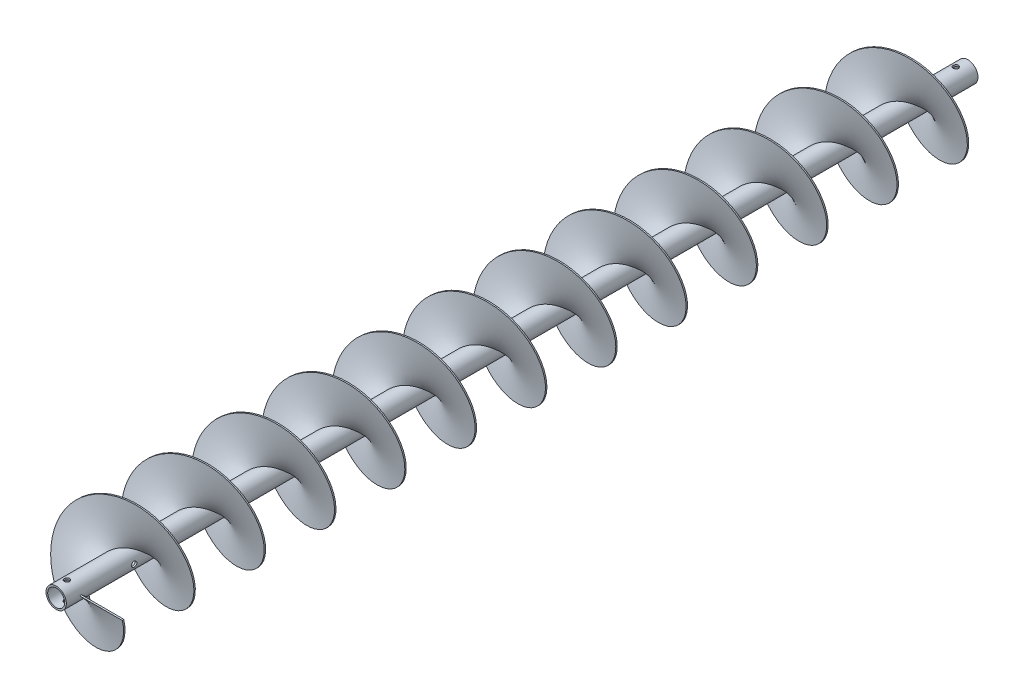
from build123d import *

# Parameters (mm, degrees)
SKETCH1_R               = 21
SKETCH1_R_2             = 17.5
EXTRUDE_THIN1_DEPTH     = 1880
SWEEP1_PITCH            = 145
SWEEP1_HEIGHT           = 1800
SWEEP1_RADIUS           = 65
SWEEP1_START_ANGLE      = 180
SKETCH7_W               = 88
SKETCH7_H               = 2.915603922
CUT_EXTRUDE1_DEPTH      = 1887.309629217
CUT_EXTRUDE1_DEPTH_BACK = 1887.309629217
SKETCH9_R               = 5.5
CUT_EXTRUDE2_DEPTH      = 1887.309629317
CUT_EXTRUDE2_DEPTH_BACK = 1887.309629317
SKETCH10_R              = 5.5


with BuildPart() as part:
    # Sketch1 → Extrude-Thin1 (new body)
    with BuildSketch(Plane.XY):
        Circle(SKETCH1_R)
        Circle(SKETCH1_R_2, mode=Mode.SUBTRACT)
    extrude(amount=-EXTRUDE_THIN1_DEPTH)

    # Sketch9 → Cut-Extrude1 (cut, two sides: drawn at the far end of the back side and taken through both)
    with BuildSketch(Plane(origin=(0, 0, 0), x_dir=(0, 0, -1), z_dir=(1, 0, 0)).offset(-CUT_EXTRUDE1_DEPTH_BACK)):
        with Locations((140, 0)):
            Circle(SKETCH9_R)
        with Locations((1790, 0)):
            Circle(SKETCH9_R)
    extrude(amount=CUT_EXTRUDE1_DEPTH + CUT_EXTRUDE1_DEPTH_BACK, mode=Mode.SUBTRACT)

    # Sketch10 → Cut-Extrude2 (cut, two sides: drawn at the far end of the back side and taken through both)
    with BuildSketch(Plane(origin=(0, 0, 0), x_dir=(1, 0, 0), z_dir=(0, 1, 0)).offset(-CUT_EXTRUDE2_DEPTH_BACK)):
        with Locations(Location((0, 22, 0), (0, 0, 270))):
            Circle(SKETCH10_R)
        with Locations(Location((0, 1855, 0), (0, 0, 270))):
            Circle(SKETCH10_R)
    extrude(amount=CUT_EXTRUDE2_DEPTH + CUT_EXTRUDE2_DEPTH_BACK, mode=Mode.SUBTRACT)


with BuildPart() as body_2:
    # Sweep1: sweep along a helix
    with BuildLine() as sweep1_path:
        add(Helix(SWEEP1_PITCH, SWEEP1_HEIGHT, SWEEP1_RADIUS, center=(0, 0, -27.5), direction=(0, 0, -1), mode=Mode.PRIVATE).rotate(Axis((0, 0, -27.5), (0, 0, -1)), SWEEP1_START_ANGLE))
    # Sketch7 → Sweep1 (sweep)
    with BuildSketch(Plane(origin=(65, 0, -27.5), x_dir=(-1, 0, 0), z_dir=(0, -0.9423685575231987, -0.3345766007832073))):
        with Locations((0, 1.542198039)):
            Rectangle(SKETCH7_W, SKETCH7_H)
    sweep(path=sweep1_path.line, is_frenet=True)


solid = Compound([part.part, body_2.part])
